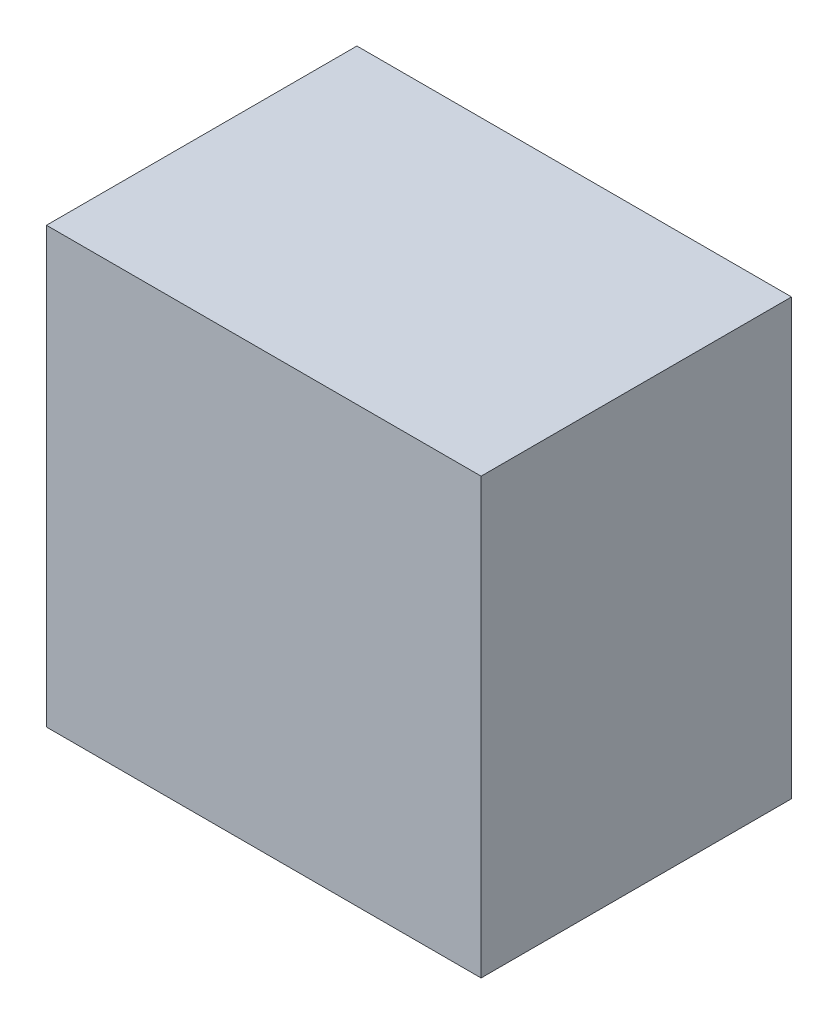
from build123d import *

# Parameters (mm, degrees)
SM_MOTOR_HELEZON_57X57X40_1_START = -740
SKETCH1_W                         = 56
SKETCH1_H                         = 56
SM_MOTOR_HELEZON_57X57X40_1_DEPTH = 40


with BuildPart() as part:
    # Sketch1 → SM_motor_helezon_57x57x40_1 (new body)
    with BuildSketch(Plane.XY.offset(SM_MOTOR_HELEZON_57X57X40_1_START)):
        with Locations((0, 68)):
            Rectangle(SKETCH1_W, SKETCH1_H)
    extrude(amount=-SM_MOTOR_HELEZON_57X57X40_1_DEPTH)


solid = part.part
